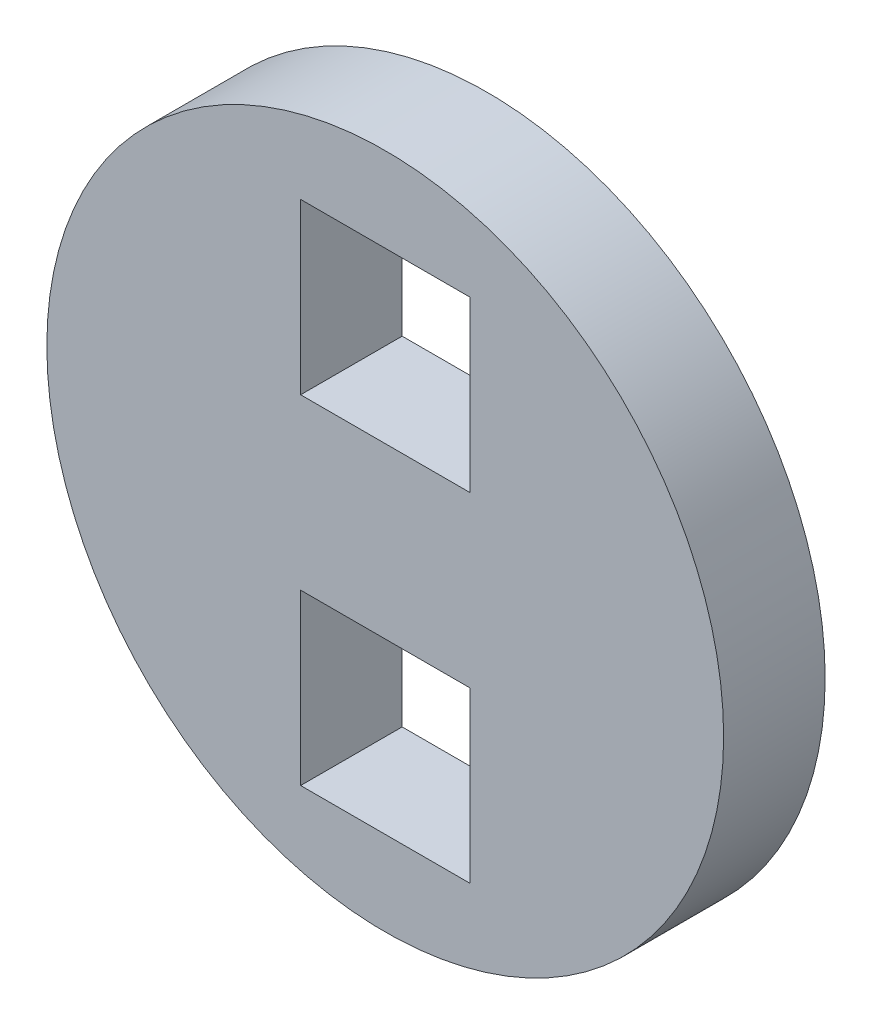
from build123d import *

# Parameters (mm, degrees)
ESQUISSE1_R        = 10
ESQUISSE1_W        = 5
ESQUISSE1_H        = 5
BOSS_EXTRU_1_DEPTH = 3


with BuildPart() as part:
    # Esquisse1 → Boss.-Extru.1 (new body)
    with BuildSketch(Plane.XY):
        Circle(ESQUISSE1_R)
        with Locations((0, -5)):
            Rectangle(ESQUISSE1_W, ESQUISSE1_H, mode=Mode.SUBTRACT)
        with Locations((0, 5)):
            Rectangle(ESQUISSE1_W, ESQUISSE1_H, mode=Mode.SUBTRACT)
    extrude(amount=BOSS_EXTRU_1_DEPTH)


solid = part.part
